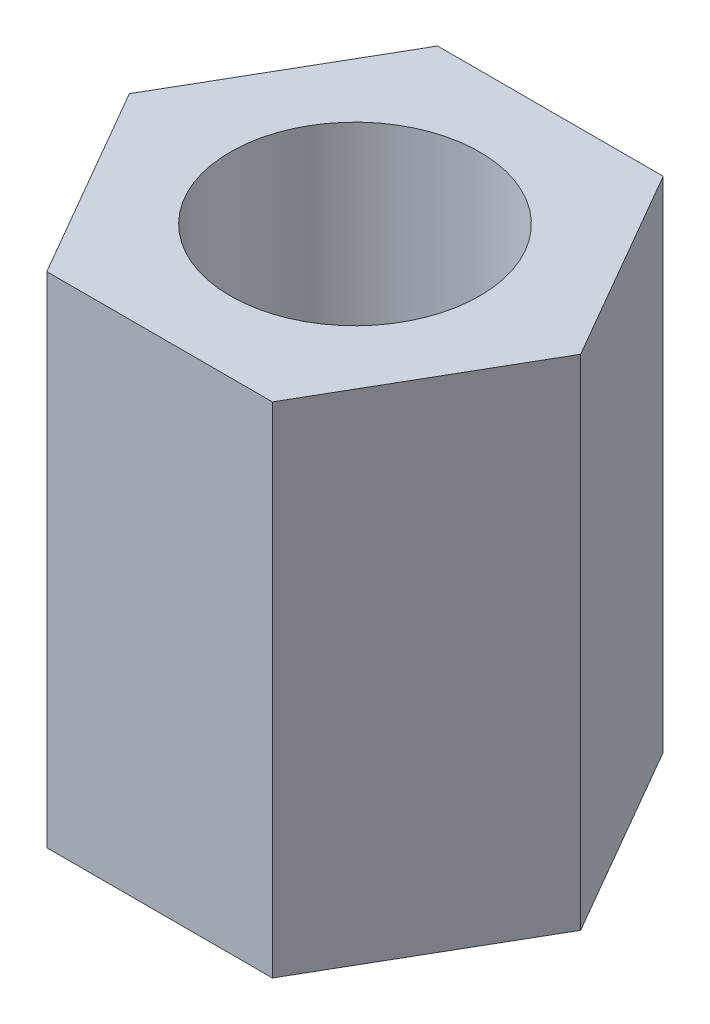
from build123d import *

# Parameters (mm, degrees)
SKETCH_1_R      = 1.5
EXTRUDE_1_DEPTH = 6


with BuildPart() as part:
    # 草图1 → 凸台-拉伸1 (new body)
    with BuildSketch(Plane(origin=(0, 0, 0), x_dir=(1, 0, 0), z_dir=(0, 1, 0))):
        Polygon((2.713546265, 0), (1.356773133, 2.35), (-1.356773133, 2.35), (-2.713546265, 0), (-1.356773133, -2.35), (1.356773133, -2.35), align=None)
        with Locations(Location((0, 0, 0), (0, 0, 270))):
            Circle(SKETCH_1_R, mode=Mode.SUBTRACT)
    extrude(amount=EXTRUDE_1_DEPTH)


solid = part.part
